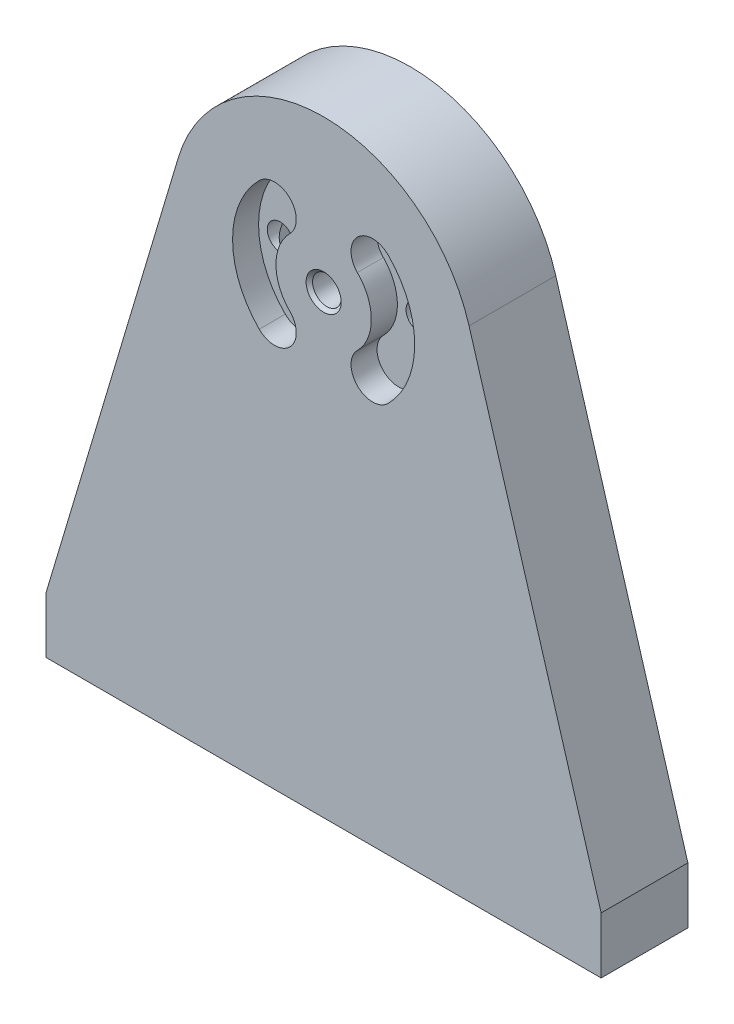
from build123d import *

# Parameters (mm, degrees)
Y_KSEKLIK_EKSTR_ZYON1_DEPTH = 5
M4_DI_LI_DELIK1_D           = 3.3
M4_DI_LI_DELIK1_CSINK_D     = 4.05
M4_DI_LI_DELIK1_CSINK_ANGLE = 90
M4_DI_LI_DELIK2_D           = 3.3
M4_DI_LI_DELIK2_DEPTH       = 12
M4_DI_LI_DELIK2_CSINK_D     = 4.05
M4_DI_LI_DELIK2_CSINK_ANGLE = 90
M4_DI_LI_DELIK2_TIP         = 0.991420021
IZIM12_R                    = 1.5
KES_EKSTR_ZYON1_DEPTH       = 54
KES_EKSTR_ZYON2_DEPTH       = 3
IZIM14_R                    = 1.5
KES_EKSTR_ZYON3_DEPTH       = 5


with BuildPart() as part:
    # Çizim2 → Yükseklik-Ekstrüzyon1 (new, symmetric)
    with BuildSketch(Plane.XY):
        with BuildLine():
            Line((-32, 0), (32, 0))
            Line((32, 0), (32, 6.5))
            Line((32, 6.5), (16.768327291, 57.507314637))
            ThreePointArc((16.768327291, 57.507314637), (0, 70), (-16.768327291, 57.507314637))
            Line((-16.768327291, 57.507314637), (-32, 6.5))
            Line((-32, 6.5), (-32, 0))
        make_face()
    extrude(amount=Y_KSEKLIK_EKSTR_ZYON1_DEPTH, both=True)

    # M4 Dişli Delik1 (through all)
    with Locations(Plane.XY.offset(5)):
        with Locations((0, 52.5)):
            CounterSinkHole(M4_DI_LI_DELIK1_D / 2, M4_DI_LI_DELIK1_CSINK_D / 2, counter_sink_angle=M4_DI_LI_DELIK1_CSINK_ANGLE)

    # M4 Dişli Delik2
    with Locations(Plane(origin=(0, 0, 0), x_dir=(-1, 0, 0), z_dir=(0, -1, 0))):
        with Locations((22, 0), (-22, 0)):
            CounterSinkHole(M4_DI_LI_DELIK2_D / 2, M4_DI_LI_DELIK2_CSINK_D / 2, depth=M4_DI_LI_DELIK2_DEPTH, counter_sink_angle=M4_DI_LI_DELIK2_CSINK_ANGLE)
            with Locations((0, 0, -(M4_DI_LI_DELIK2_DEPTH + M4_DI_LI_DELIK2_TIP / 2))):  # 118° drill point
                Cone(0, M4_DI_LI_DELIK2_D / 2, M4_DI_LI_DELIK2_TIP, mode=Mode.SUBTRACT)

    # Çizim12 → Kes-Ekstrüzyon1 (cut)
    with BuildSketch(Plane.XZ):
        with Locations((-8, 0)):
            Circle(IZIM12_R)
        with Locations((8, 0)):
            Circle(IZIM12_R)
    extrude(amount=-KES_EKSTR_ZYON1_DEPTH, mode=Mode.SUBTRACT)

    # Çizim13 → Kes-Ekstrüzyon2 (cut)
    with BuildSketch(Plane(origin=(0, 0, 5), x_dir=(-1, 0, 0), z_dir=(0, 0, -1))):
        with BuildLine():
            ThreePointArc((7.424621202, 45.075378798), (10.5, 52.5), (7.424621202, 59.924621202))
            ThreePointArc((7.424621202, 59.924621202), (3.889087297, 59.924621202), (3.889087297, 56.389087297))
            ThreePointArc((3.889087297, 56.389087297), (5.5, 52.5), (3.889087297, 48.610912703))
            ThreePointArc((3.889087297, 48.610912703), (3.889087297, 45.075378798), (7.424621202, 45.075378798))
        make_face()
        with BuildLine():
            ThreePointArc((-7.424621202, 45.075378798), (-10.5, 52.5), (-7.424621202, 59.924621202))
            ThreePointArc((-7.424621202, 59.924621202), (-3.889087297, 59.924621202), (-3.889087297, 56.389087297))
            ThreePointArc((-3.889087297, 56.389087297), (-5.5, 52.5), (-3.889087297, 48.610912703))
            ThreePointArc((-3.889087297, 48.610912703), (-3.889087297, 45.075378798), (-7.424621202, 45.075378798))
        make_face()
    extrude(amount=KES_EKSTR_ZYON2_DEPTH, mode=Mode.SUBTRACT)

    # Çizim14 → Kes-Ekstrüzyon3 (cut)
    with BuildSketch(Plane.XY.offset(2)):
        with Locations((-8, 52.5)):
            Circle(IZIM14_R)
        with Locations((8, 52.5)):
            Circle(IZIM14_R)
    extrude(amount=-KES_EKSTR_ZYON3_DEPTH, mode=Mode.SUBTRACT)


solid = part.part
